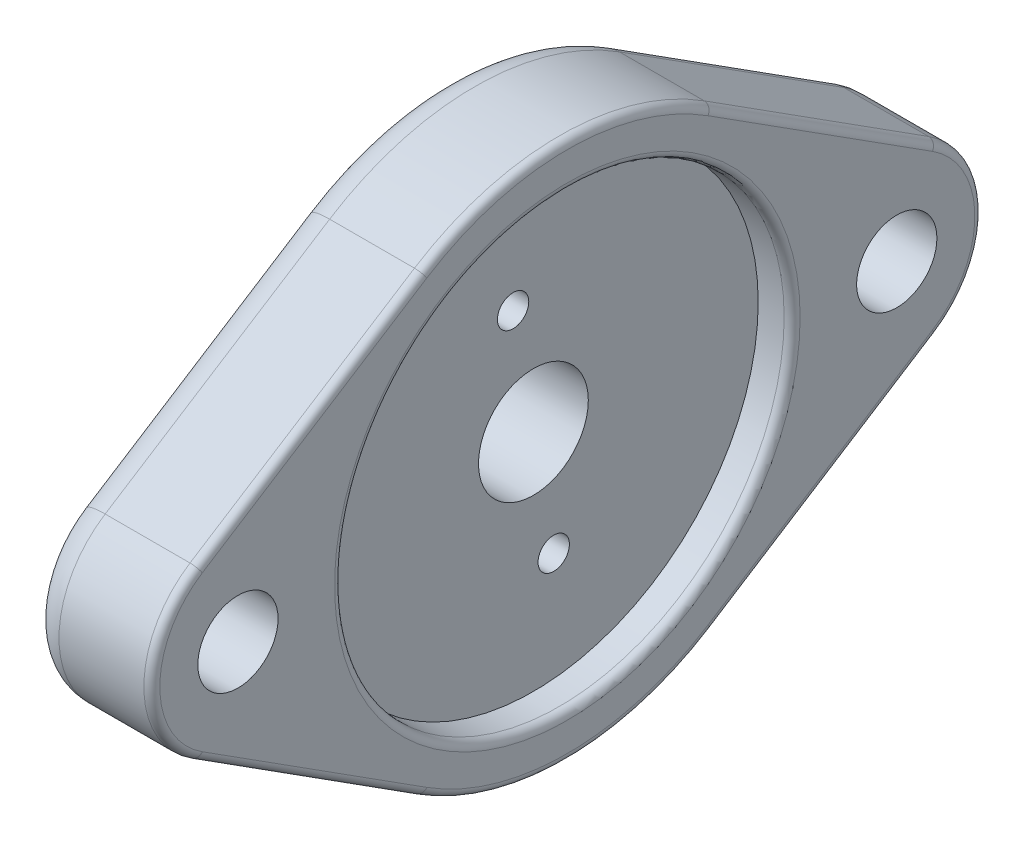
from build123d import *

# Parameters (mm, degrees)
BOSS_EXTRUDE3_DEPTH       = 7.9375
SKETCH5_R                 = 3.4925
CUT_EXTRUDE4_DEPTH        = 33.489674755
SKETCH6_R                 = 14.3002
CUT_EXTRUDE5_DEPTH        = 2.159
TAP_DRILL_FOR_3_48_TAP2_D = 1.9939
F_10_CLEARANCE_HOLE1_D    = 5.1054
FILLET1_R                 = 2.032
FILLET2_R                 = 0.508


with BuildPart() as part:
    # Sketch1 → Boss-Extrude3 (new body)
    with BuildSketch(Plane(origin=(0, 0, 0), x_dir=(0, 0, -1), z_dir=(1, 0, 0))):
        with BuildLine():
            Line((9.216458059, 14.457106413), (23.495, 5.354483857))
            ThreePointArc((23.495, 5.354483857), (26.431497015, 0), (23.495, -5.354483857))
            Line((23.495, -5.354483857), (9.216458059, -14.457106413))
            ThreePointArc((9.216458059, -14.457106413), (0, -17.145), (-9.216458059, -14.457106413))
            Line((-9.216458059, -14.457106413), (-23.495, -5.354483857))
            ThreePointArc((-23.495, -5.354483857), (-26.431497015, 0), (-23.495, 5.354483857))
            Line((-23.495, 5.354483857), (-9.216458059, 14.457106413))
            ThreePointArc((-9.216458059, 14.457106413), (0, 17.145), (9.216458059, 14.457106413))
        make_face()
    extrude(amount=BOSS_EXTRUDE3_DEPTH)

    # Sketch5 → Cut-Extrude4 (cut, through all)
    with BuildSketch(Plane(origin=(7.9375, 0, 0), x_dir=(0, 0, -1), z_dir=(1, 0, 0))):
        Circle(SKETCH5_R)
    extrude(amount=-CUT_EXTRUDE4_DEPTH, mode=Mode.SUBTRACT)

    # Sketch6 → Cut-Extrude5 (cut)
    with BuildSketch(Plane(origin=(7.9375, 0, 0), x_dir=(0, 0, -1), z_dir=(1, 0, 0))):
        Circle(SKETCH6_R)
    extrude(amount=-CUT_EXTRUDE5_DEPTH, mode=Mode.SUBTRACT)

    # Tap Drill for #3-48 Tap2 (through all)
    with Locations(Plane(origin=(5.7785, 0, 0), x_dir=(0, 0, -1), z_dir=(1, 0, 0))):
        with Locations((-1.292324468, 7.329136259), (1.292324468, -7.329136259)):
            Hole(TAP_DRILL_FOR_3_48_TAP2_D / 2)

    # #10 Clearance Hole1 (through all)
    with Locations(Plane(origin=(7.9375, 0, 0), x_dir=(0, 0, -1), z_dir=(1, 0, 0))):
        with Locations((-20.955, 0), (20.955, 0), (9.900488765, 18.695562828)):
            Hole(F_10_CLEARANCE_HOLE1_D / 2)

    # Fillet1
    fillet1_edges = [part.edges().sort_by_distance(p)[0] for p in [
        (0, 9.905795135, 16.355729029),
        (0, 17.145, 0),
        (0, 9.905795135, -16.355729029),
        (0, 0, -26.431497015),
        (0, -9.905795135, -16.355729029),
        (0, -17.145, 0),
        (0, -9.905795135, 16.355729029),
        (0, 0, 26.431497015),
    ]]
    fillet(fillet1_edges, radius=FILLET1_R)

    # Fillet2
    fillet2_edges = [part.edges().sort_by_distance(p)[0] for p in [
        (7.9375, 0, 26.431497015),
        (7.9375, -9.905795135, 16.355729029),
        (7.9375, -17.145, 0),
        (7.9375, -9.905795135, -16.355729029),
        (7.9375, 0, -26.431497015),
        (7.9375, 9.905795135, -16.355729029),
        (7.9375, 0, 14.3002),
        (7.9375, 17.145, 0),
        (7.9375, 9.905795135, 16.355729029),
    ]]
    fillet(fillet2_edges, radius=FILLET2_R)


solid = part.part
